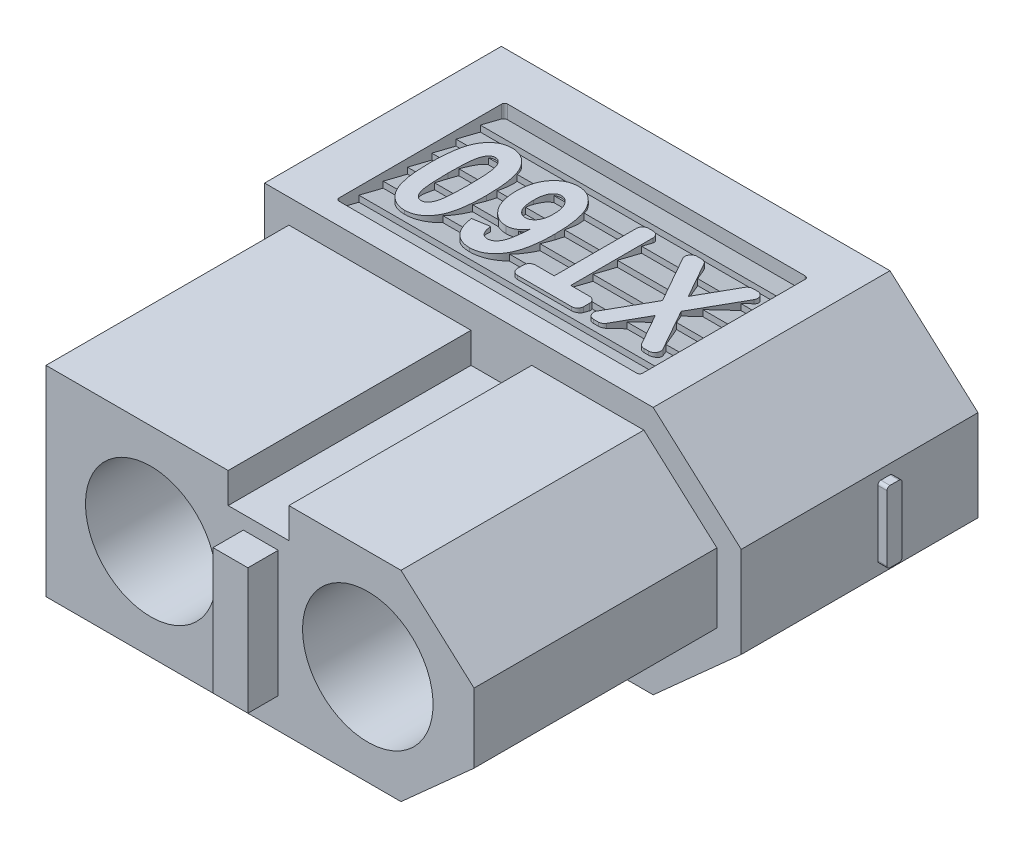
from build123d import *

# Parameters (mm, degrees)
RESSALTO_EXTRUS_O1_DEPTH  = 15.8
CORTE_EXTRUS_O1_DEPTH     = 8
ESBO_O5_R                 = 3
CORTE_EXTRUS_O3_DEPTH     = 2
ESBO_O6_R                 = 2.15
CORTE_EXTRUS_O4_DEPTH     = 23.453730202
RESSALTO_EXTRUS_O3_DEPTH  = 0.3
RESSALTO_EXTRUS_O4_DEPTH  = 0.3
CORTE_EXTRUS_O5_DEPTH     = 0.75
RESSALTO_EXTRUS_O7_REACH  = 24.865
RESSALTO_EXTRUS_O8_DEPTH  = 0.3
RESSALTO_EXTRUS_O9_DEPTH  = 0.3
ESBO_O13_W                = 1.15
ESBO_O13_H                = 4.15
RESSALTO_EXTRUS_O10_DEPTH = 1


with BuildPart() as part:
    # Esboço1 → Ressalto-extrusão1 (new body)
    with BuildSketch(Plane.XY):
        Polygon((0, 0), (12.8, 0), (15.7, 2.6), (15.7, 5.6), (12.8, 8.2), (0, 8.2), align=None)
    extrude(amount=RESSALTO_EXTRUS_O1_DEPTH)

    # Esboço2 → Corte-extrusão1 (cut)
    with BuildSketch(Plane.XY.offset(15.8)):
        Polygon((0, 8.2), (0, 0), (12.8, 0), (15.7, 2.6), (15.7, 5.6), (12.8, 8.2), align=None)
        Polygon((0.8, 7.4), (0.8, 0.8), (12.49388664, 0.8), (14.9, 2.957205081), (14.9, 5.242794919), (12.49388664, 7.4), (8.8, 7.4), (8.8, 6.4), (6.8, 6.4), (6.8, 7.4), align=None, mode=Mode.SUBTRACT)
    extrude(amount=-CORTE_EXTRUS_O1_DEPTH, mode=Mode.SUBTRACT)

    # Esboço5 → Corte-extrusão3 (cut)
    with BuildSketch(Plane(origin=(0, 0, 0), x_dir=(-1, 0, 0), z_dir=(0, 0, -1))):
        with Locations((-11.4, 4.1)):
            Circle(ESBO_O5_R)
        with Locations((-4.25, 4.1)):
            Circle(ESBO_O5_R)
    extrude(amount=-CORTE_EXTRUS_O3_DEPTH, mode=Mode.SUBTRACT)

    # Esboço6 → Corte-extrusão4 (cut, through all)
    with BuildSketch(Plane(origin=(0, 0, 2), x_dir=(-1, 0, 0), z_dir=(0, 0, -1))):
        with Locations((-11.4, 4.1)):
            Circle(ESBO_O6_R)
        with Locations((-4.25, 4.1)):
            Circle(ESBO_O6_R)
    extrude(amount=-CORTE_EXTRUS_O4_DEPTH, mode=Mode.SUBTRACT)

    # Esboço7 → Ressalto-extrusão3 (add)
    with BuildSketch(Plane.ZY):
        with BuildLine():
            Line((2.8, 4.35), (2.05, 4.35))
            ThreePointArc((2.05, 4.35), (1.979289322, 4.320710678), (1.95, 4.25))
            Line((1.95, 4.25), (1.95, 3.95))
            ThreePointArc((1.95, 3.95), (1.979289322, 3.879289322), (2.05, 3.85))
            Line((2.05, 3.85), (2.8, 3.85))
            ThreePointArc((2.8, 3.85), (2.870710678, 3.820710678), (2.9, 3.75))
            Line((2.9, 3.75), (2.9, 3))
            ThreePointArc((2.9, 3), (2.929289322, 2.929289322), (3, 2.9))
            Line((3, 2.9), (3.3, 2.9))
            ThreePointArc((3.3, 2.9), (3.370710678, 2.929289322), (3.4, 3))
            Line((3.4, 3), (3.4, 3.75))
            ThreePointArc((3.4, 3.75), (3.429289322, 3.820710678), (3.5, 3.85))
            Line((3.5, 3.85), (4.25, 3.85))
            ThreePointArc((4.25, 3.85), (4.320710678, 3.879289322), (4.35, 3.95))
            Line((4.35, 3.95), (4.35, 4.25))
            ThreePointArc((4.35, 4.25), (4.320710678, 4.320710678), (4.25, 4.35))
            Line((4.25, 4.35), (3.5, 4.35))
            ThreePointArc((3.5, 4.35), (3.429289322, 4.379289322), (3.4, 4.45))
            Line((3.4, 4.45), (3.4, 5.2))
            ThreePointArc((3.4, 5.2), (3.370710678, 5.270710678), (3.3, 5.3))
            Line((3.3, 5.3), (3, 5.3))
            ThreePointArc((3, 5.3), (2.929289322, 5.270710678), (2.9, 5.2))
            Line((2.9, 5.2), (2.9, 4.45))
            ThreePointArc((2.9, 4.45), (2.870710678, 4.379289322), (2.8, 4.35))
        make_face()
    extrude(amount=RESSALTO_EXTRUS_O3_DEPTH)

    # Esboço8 → Ressalto-extrusão4 (add)
    with BuildSketch(Plane(origin=(15.7, 0, 0), x_dir=(0, 0, -1), z_dir=(1, 0, 0))):
        with BuildLine():
            Line((-3.2, 2.925), (-2.9, 2.925))
            ThreePointArc((-2.9, 2.925), (-2.829289322, 2.954289322), (-2.8, 3.025))
            Line((-2.8, 3.025), (-2.8, 5.175))
            ThreePointArc((-2.8, 5.175), (-2.829289322, 5.245710678), (-2.9, 5.275))
            Line((-2.9, 5.275), (-3.2, 5.275))
            ThreePointArc((-3.2, 5.275), (-3.270710678, 5.245710678), (-3.3, 5.175))
            Line((-3.3, 5.175), (-3.3, 3.025))
            ThreePointArc((-3.3, 3.025), (-3.270710678, 2.954289322), (-3.2, 2.925))
        make_face()
    extrude(amount=RESSALTO_EXTRUS_O4_DEPTH)

    # Esboço9 → Corte-extrusão5 (cut)
    with BuildSketch(Plane.XZ):
        with BuildLine():
            Line((1.75, 7.093123445), (11.55, 7.093123445))
            ThreePointArc((11.55, 7.093123445), (11.620710678, 7.063834123), (11.65, 6.993123445))
            Line((11.65, 6.993123445), (11.65, 1.643123445))
            ThreePointArc((11.65, 1.643123445), (11.620710678, 1.572412766), (11.55, 1.543123445))
            Line((11.55, 1.543123445), (1.75, 1.543123445))
            ThreePointArc((1.75, 1.543123445), (1.679289322, 1.572412766), (1.65, 1.643123445))
            Line((1.65, 1.643123445), (1.65, 6.993123445))
            ThreePointArc((1.65, 6.993123445), (1.679289322, 7.063834123), (1.75, 7.093123445))
        make_face()
    corte_extrus_o5 = extrude(amount=-CORTE_EXTRUS_O5_DEPTH, mode=Mode.SUBTRACT)

    # Ressalto-extrusão7: up to this face of the body (flat: up to its plane)
    ressalto_extrus_o7_end = Plane(part.part.faces().sort_by_distance((11.65, 0.375, 4.318123445))[0])
    # Esboço10 → Ressalto-extrusão7 (add, up to the picked face)
    with BuildSketch(Plane(origin=(1.65, 0, 0), x_dir=(0, 0, -1), z_dir=(1, 0, 0)), mode=Mode.PRIVATE) as ressalto_extrus_o7_sk1:
        Polygon((-3.143123445, 0.45), (-3.143123445, 0.25), (-2.343123445, 0.45), (-2.343123445, 0.25), (-1.543123445, 0.45), (-1.543123445, 0.75), (-7.143123445, 0.75), (-7.143123445, 0.45), (-7.143123445, 0.25), (-6.343123445, 0.45), (-6.343123445, 0.25), (-5.543123445, 0.45), (-5.543123445, 0.25), (-4.743123445, 0.45), (-4.743123445, 0.25), (-3.943123445, 0.45), (-3.943123445, 0.25), align=None)
    ressalto_extrus_o7_tool1 = split(extrude(ressalto_extrus_o7_sk1.sketch, amount=RESSALTO_EXTRUS_O7_REACH, mode=Mode.PRIVATE), bisect_by=ressalto_extrus_o7_end, keep=Keep.BOTH, mode=Mode.PRIVATE)
    ressalto_extrus_o7 = ressalto_extrus_o7_tool1.solids().sort_by(Axis((1.65, 0.545833, 4.376457), (1, 0, 0)))[0]
    add(ressalto_extrus_o7)

    # Espelhar1: Corte-extrusão5, Ressalto-extrusão7 across plane
    add(corte_extrus_o5.mirror(Plane.ZX.offset(4.1)), mode=Mode.SUBTRACT)
    add(ressalto_extrus_o7.mirror(Plane.ZX.offset(4.1)))

    # Esboço11 → Ressalto-extrusão8 (add)
    with BuildSketch(Plane(origin=(0, 0.5, 0), x_dir=(-1, 0, 0), z_dir=(0, -1, 0))):
        with BuildLine():
            Line((-2.594171468, -5.543123445), (-2.816677367, -5.543123445))
            ThreePointArc((-2.816677367, -5.543123445), (-2.931584034, -5.489541586), (-2.96439853, -5.367076218))
            Line((-2.96439853, -5.367076218), (-2.475213344, -2.592769164))
            ThreePointArc((-2.475213344, -2.592769164), (-2.50802784, -2.470303795), (-2.622934507, -2.416721937))
            Line((-2.622934507, -2.416721937), (-2.922945856, -2.416721937))
            ThreePointArc((-2.922945856, -2.416721937), (-3.019363998, -2.45181527), (-3.070667019, -2.54067471))
            Line((-3.070667019, -2.54067471), (-3.578223521, -5.419170671))
            ThreePointArc((-3.578223521, -5.419170671), (-3.629526543, -5.508030111), (-3.725944684, -5.543123445))
            Line((-3.725944684, -5.543123445), (-4.285644183, -5.543123445))
            ThreePointArc((-4.285644183, -5.543123445), (-4.3917102, -5.587057427), (-4.435644183, -5.693123445))
            Line((-4.435644183, -5.693123445), (-4.435644183, -5.993134794))
            ThreePointArc((-4.435644183, -5.993134794), (-4.3917102, -6.099200812), (-4.285644183, -6.143134794))
            Line((-4.285644183, -6.143134794), (-2.594171468, -6.143134794))
            ThreePointArc((-2.594171468, -6.143134794), (-2.48810545, -6.099200812), (-2.444171468, -5.993134794))
            Line((-2.444171468, -5.993134794), (-2.444171468, -5.693123445))
            ThreePointArc((-2.444171468, -5.693123445), (-2.48810545, -5.587057427), (-2.594171468, -5.543123445))
        make_face()
        with BuildLine():
            Line((-7.312799939, -6.143134794), (-5.987200061, -6.143134794))
            ThreePointArc((-5.987200061, -6.143134794), (-5.912200061, -6.123038605), (-5.85729625, -6.068134794))
            Line((-5.85729625, -6.068134794), (-5.828687438, -6.018582878))
            ThreePointArc((-5.828687438, -6.018582878), (-5.681353004, -5.702623165), (-5.591122739, -5.365879233))
            Line((-5.591122739, -5.365879233), (-5.150689111, -2.868056003))
            ThreePointArc((-5.150689111, -2.868056003), (-5.158867923, -2.786982124), (-5.208226408, -2.722146896))
            Line((-5.208226408, -2.722146896), (-5.574105578, -2.446860057))
            ThreePointArc((-5.574105578, -2.446860057), (-5.616746211, -2.424455845), (-5.664289444, -2.416721937))
            Line((-5.664289444, -2.416721937), (-6.747162349, -2.416721937))
            ThreePointArc((-6.747162349, -2.416721937), (-6.822162349, -2.436818126), (-6.877066159, -2.491721937))
            Line((-6.877066159, -2.491721937), (-7.246378339, -3.131389396))
            ThreePointArc((-7.246378339, -3.131389396), (-7.254434815, -3.146865743), (-7.261111782, -3.162985367))
            Line((-7.261111782, -3.162985367), (-7.486707327, -3.782804031))
            ThreePointArc((-7.486707327, -3.782804031), (-7.491953968, -3.799444251), (-7.495730353, -3.816478424))
            Line((-7.495730353, -3.816478424), (-7.600238849, -4.409175555))
            ThreePointArc((-7.600238849, -4.409175555), (-7.567424352, -4.531640924), (-7.452517686, -4.585222782))
            Line((-7.452517686, -4.585222782), (-6.814596908, -4.585222782))
            ThreePointArc((-6.814596908, -4.585222782), (-6.708530891, -4.541288799), (-6.664596908, -4.435222782))
            Line((-6.664596908, -4.435222782), (-6.664596908, -4.135222782))
            ThreePointArc((-6.664596908, -4.135222782), (-6.688852376, -4.053440677), (-6.75377441, -3.998107415))
            ThreePointArc((-6.75377441, -3.998107415), (-6.813094, -3.957706293), (-6.85433126, -3.898964887))
            Line((-6.85433126, -3.898964887), (-6.980409874, -3.625265301))
            ThreePointArc((-6.980409874, -3.625265301), (-6.998662224, -3.535451732), (-6.974936214, -3.446926583))
            Line((-6.974936214, -3.446926583), (-6.800387282, -3.122061179))
            ThreePointArc((-6.800387282, -3.122061179), (-6.726842336, -3.045065082), (-6.624207428, -3.016721937))
            Line((-6.624207428, -3.016721937), (-5.905334252, -3.016721937))
            ThreePointArc((-5.905334252, -3.016721937), (-5.828729808, -3.052443176), (-5.806853477, -3.134086755))
            Line((-5.806853477, -3.134086755), (-6.209775425, -5.419170671))
            ThreePointArc((-6.209775425, -5.419170671), (-6.261078446, -5.508030111), (-6.357496588, -5.543123445))
            Line((-6.357496588, -5.543123445), (-7.076369764, -5.543123445))
            ThreePointArc((-7.076369764, -5.543123445), (-7.152974208, -5.507402206), (-7.174850539, -5.425758627))
            Line((-7.174850539, -5.425758627), (-7.151219061, -5.291737858))
            ThreePointArc((-7.151219061, -5.291737858), (-7.184033558, -5.16927249), (-7.298940224, -5.115690631))
            Line((-7.298940224, -5.115690631), (-7.598951574, -5.115690631))
            ThreePointArc((-7.598951574, -5.115690631), (-7.695369716, -5.150783965), (-7.746672737, -5.239643405))
            Line((-7.746672737, -5.239643405), (-7.826400273, -5.691800728))
            ThreePointArc((-7.826400273, -5.691800728), (-7.81822146, -5.772874607), (-7.768862976, -5.837709835))
            Line((-7.768862976, -5.837709835), (-7.402983805, -6.112996674))
            ThreePointArc((-7.402983805, -6.112996674), (-7.360343172, -6.135400887), (-7.312799939, -6.143134794))
        make_face()
        with BuildLine():
            Line((-8.976581944, -6.143134794), (-9.276593294, -6.143134794))
            ThreePointArc((-9.276593294, -6.143134794), (-9.383119611, -6.098738505), (-9.426587619, -5.991830045))
            Line((-9.426587619, -5.991830045), (-9.419815007, -5.213249059))
            ThreePointArc((-9.419815007, -5.213249059), (-9.453507368, -5.165547636), (-9.509444688, -5.182329089))
            Line((-9.509444688, -5.182329089), (-10.203473932, -6.084589954))
            ThreePointArc((-10.203473932, -6.084589954), (-10.256105062, -6.127704988), (-10.32236865, -6.143134794))
            Line((-10.32236865, -6.143134794), (-10.62238, -6.143134794))
            ThreePointArc((-10.62238, -6.143134794), (-10.756950193, -6.059398382), (-10.741274717, -5.901679635))
            Line((-10.741274717, -5.901679635), (-9.415426652, -4.178033505))
            Line((-9.415426652, -4.178033505), (-9.12671612, -2.54067471))
            ThreePointArc((-9.12671612, -2.54067471), (-9.075413098, -2.45181527), (-8.978994957, -2.416721937))
            Line((-8.978994957, -2.416721937), (-8.678983607, -2.416721937))
            ThreePointArc((-8.678983607, -2.416721937), (-8.56407694, -2.470303795), (-8.531262444, -2.592769164))
            Line((-8.531262444, -2.592769164), (-8.810787319, -4.178033505))
            Line((-8.810787319, -4.178033505), (-8.826587619, -5.994439544))
            ThreePointArc((-8.826587619, -5.994439544), (-8.870978233, -6.099661111), (-8.976581944, -6.143134794))
        make_face()
    extrude(amount=RESSALTO_EXTRUS_O8_DEPTH)

    # Esboço12 → Ressalto-extrusão9 (add)
    # profile 1 of 4: a face of its own
    with BuildSketch(Plane(origin=(0, 7.7, 0), x_dir=(1, 0, 0), z_dir=(0, 1, 0))):
        with BuildLine():
            Line((11.185044584, -2.866454717), (10.320104725, -4.398379126))
            Line((10.320104725, -4.398379126), (11.094198639, -5.769814539))
            ThreePointArc((11.094198639, -5.769814539), (11.092744365, -5.968965447), (10.920028151, -6.068123445))
            Line((10.920028151, -6.068123445), (10.7649422, -6.068123445))
            ThreePointArc((10.7649422, -6.068123445), (10.664138477, -6.040862003), (10.590815302, -5.966509539))
            Line((10.590815302, -5.966509539), (10.012576316, -4.943123445))
            Line((10.012576316, -4.943123445), (9.435030455, -5.966426179))
            ThreePointArc((9.435030455, -5.966426179), (9.361701545, -6.040837872), (9.260856483, -6.068123445))
            Line((9.260856483, -6.068123445), (9.105124481, -6.068123445))
            ThreePointArc((9.105124481, -6.068123445), (8.932408267, -5.968965447), (8.930953993, -5.769814539))
            Line((8.930953993, -5.769814539), (9.705047907, -4.398379126))
            Line((9.705047907, -4.398379126), (8.840108048, -2.866454717))
            ThreePointArc((8.840108048, -2.866454717), (8.841543221, -2.667292533), (9.01426591, -2.568123445))
            Line((9.01426591, -2.568123445), (9.169940798, -2.568123445))
            ThreePointArc((9.169940798, -2.568123445), (9.270790107, -2.595411497), (9.344119604, -2.669829276))
            Line((9.344119604, -2.669829276), (10.012576316, -3.854345035))
            Line((10.012576316, -3.854345035), (10.681728288, -2.669756355))
            ThreePointArc((10.681728288, -2.669756355), (10.755052773, -2.595390388), (10.855865922, -2.568123445))
            Line((10.855865922, -2.568123445), (11.010886722, -2.568123445))
            ThreePointArc((11.010886722, -2.568123445), (11.183609411, -2.667292533), (11.185044584, -2.866454717))
        make_face()
    # profile 2 of 4: a face of its own
    with BuildSketch(Plane(origin=(0, 7.7, 0), x_dir=(1, 0, 0), z_dir=(0, 1, 0))):
        with BuildLine():
            Line((7.762576316, -2.768123445), (7.762576316, -5.477214354))
            Line((7.762576316, -5.477214354), (8.380758134, -5.477214354))
            ThreePointArc((8.380758134, -5.477214354), (8.522179491, -5.535792997), (8.580758134, -5.677214354))
            Line((8.580758134, -5.677214354), (8.580758134, -5.868123445))
            ThreePointArc((8.580758134, -5.868123445), (8.522179491, -6.009544801), (8.380758134, -6.068123445))
            Line((8.380758134, -6.068123445), (6.598939953, -6.068123445))
            ThreePointArc((6.598939953, -6.068123445), (6.457518596, -6.009544801), (6.398939953, -5.868123445))
            Line((6.398939953, -5.868123445), (6.398939953, -5.677214354))
            ThreePointArc((6.398939953, -5.677214354), (6.457518596, -5.535792997), (6.598939953, -5.477214354))
            Line((6.598939953, -5.477214354), (7.217121771, -5.477214354))
            Line((7.217121771, -5.477214354), (7.217121771, -2.768123445))
            ThreePointArc((7.217121771, -2.768123445), (7.275700414, -2.626702088), (7.417121771, -2.568123445))
            Line((7.417121771, -2.568123445), (7.562576316, -2.568123445))
            ThreePointArc((7.562576316, -2.568123445), (7.703997672, -2.626702088), (7.762576316, -2.768123445))
        make_face()
    # profile 3 of 4: a face of its own
    with BuildSketch(Plane(origin=(0, 7.7, 0), x_dir=(1, 0, 0), z_dir=(0, 1, 0))):
        with BuildLine():
            Line((4.217121771, -5.204487081), (4.762576316, -5.11357799))
            add(Edge.make_bspline(
                [(4.762576316, -5.11357799), (4.76820949, -5.173924633), (4.781337444, -5.259439061), (4.819168165, -5.361191101), (4.853361229, -5.419789109), (4.894424887, -5.466597978), (4.961777465, -5.510957772), (5.022038471, -5.523265851), (5.062292225, -5.522668899)],
                knots=[0, 0, 0, 0, 0.323351038, 0.457031878, 0.575725889, 0.682827962, 0.785621923, 1, 1, 1, 1], degree=3))
            add(Edge.make_bspline(
                [(5.062292225, -5.522668899), (5.090005536, -5.523271256), (5.131240753, -5.516505903), (5.183240033, -5.496464747), (5.220091612, -5.475090137), (5.254809063, -5.44738128), (5.287295538, -5.413652015), (5.318784831, -5.374418203), (5.348496948, -5.327992624), (5.375862324, -5.27190132), (5.400526587, -5.204375405), (5.42080653, -5.124170881), (5.441377932, -5.032489264), (5.456741962, -4.927718403), (5.47688134, -4.763925871), (5.485298827, -4.634283794), (5.489849043, -4.543975717)],
                knots=[0, 0, 0, 0, 0.07110629, 0.106432223, 0.14303469, 0.180361233, 0.220458154, 0.263402163, 0.309743564, 0.362096385, 0.423824058, 0.494518004, 0.575001043, 0.665717727, 0.767054977, 1, 1, 1, 1], degree=3))
            add(Edge.make_bspline(
                [(5.489849043, -4.543975717), (5.458325439, -4.59029492), (5.407025482, -4.654615722), (5.327609617, -4.725483765), (5.267100836, -4.768088661), (5.202789438, -4.800226136), (5.112590312, -4.832606749), (5.040111771, -4.83988466), (4.991979725, -4.840850717)],
                knots=[0, 0, 0, 0, 0.277998008, 0.405177954, 0.526602292, 0.643637452, 0.760548992, 1, 1, 1, 1], degree=3))
            add(Edge.make_bspline(
                [(4.991979725, -4.840850717), (4.938397795, -4.840049228), (4.857644594, -4.832427325), (4.755876709, -4.798007625), (4.682335645, -4.763632003), (4.610596897, -4.720231075), (4.542640345, -4.665558625), (4.476889163, -4.601961344), (4.414752476, -4.529006286), (4.357734038, -4.448067208), (4.307371702, -4.360004902), (4.266071161, -4.265189584), (4.230469873, -4.164568314), (4.205010426, -4.057053869), (4.1786726, -3.902079336), (4.170937798, -3.781658743), (4.171667225, -3.69951549)],
                knots=[0, 0, 0, 0, 0.103373273, 0.154207333, 0.205955138, 0.259297376, 0.315055498, 0.373346508, 0.435038939, 0.499094576, 0.56354236, 0.62980043, 0.697776404, 0.768573701, 0.842016383, 1, 1, 1, 1], degree=3))
            add(Edge.make_bspline(
                [(4.171667225, -3.69951549), (4.17185896, -3.612421658), (4.179060828, -3.485146498), (4.205900348, -3.321369203), (4.234396433, -3.20963002), (4.2696034, -3.104366118), (4.314707671, -3.007473367), (4.366288245, -2.916922605), (4.426957594, -2.835664661), (4.492885026, -2.762488286), (4.56321129, -2.698010574), (4.638016826, -2.644053991), (4.716117978, -2.599205297), (4.798442704, -2.564863658), (4.914867128, -2.532610579), (5.005897079, -2.522349793), (5.067263816, -2.522668899)],
                knots=[0, 0, 0, 0, 0.157846943, 0.230497149, 0.300424491, 0.366636184, 0.431332033, 0.493808926, 0.555163499, 0.614703094, 0.672106668, 0.727718583, 0.781520235, 0.834985538, 0.88891022, 1, 1, 1, 1], degree=3))
            add(Edge.make_bspline(
                [(5.067263816, -2.522668899), (5.134776318, -2.522388948), (5.235013241, -2.535219464), (5.362092148, -2.577511404), (5.451550186, -2.622540527), (5.536655096, -2.680446511), (5.616741921, -2.751072456), (5.692332527, -2.834441462), (5.763971124, -2.930110778), (5.82918472, -3.04081959), (5.883929661, -3.168816952), (5.931571611, -3.312472802), (5.969029009, -3.473320865), (5.999665981, -3.650168244), (6.028262771, -3.919162037), (6.035311504, -4.129776969), (6.035303589, -4.275509808)],
                knots=[0, 0, 0, 0, 0.090693495, 0.134685131, 0.179530034, 0.224912922, 0.272737739, 0.322760271, 0.375986421, 0.433203955, 0.495069598, 0.562818628, 0.636478469, 0.716917714, 0.804030531, 1, 1, 1, 1], degree=3))
            add(Edge.make_bspline(
                [(6.035303589, -4.275509808), (6.035321208, -4.423581802), (6.028586042, -4.637939475), (5.997249035, -4.911199563), (5.966641992, -5.091655496), (5.926254815, -5.255456188), (5.877882298, -5.403133674), (5.820063121, -5.534267496), (5.751835344, -5.647887006), (5.677444095, -5.746891367), (5.597624044, -5.832519938), (5.513228762, -5.905957941), (5.422406745, -5.96445997), (5.327623343, -6.011484887), (5.191786058, -6.055622146), (5.084345761, -6.068641489), (5.011866089, -6.068123445)],
                knots=[0, 0, 0, 0, 0.192657569, 0.278521348, 0.357596923, 0.430563241, 0.497752602, 0.559502274, 0.616536619, 0.669746994, 0.720292489, 0.768554988, 0.814846956, 0.860430936, 0.905808517, 1, 1, 1, 1], degree=3))
            add(Edge.make_bspline(
                [(5.011866089, -6.068123445), (4.961903446, -6.06789345), (4.888028114, -6.061626473), (4.793001037, -6.039603881), (4.725795095, -6.016102048), (4.661944049, -5.985106158), (4.600204149, -5.948907027), (4.541772821, -5.905419857), (4.487247773, -5.854566598), (4.43554269, -5.798076733), (4.390262811, -5.733146732), (4.348758109, -5.662053174), (4.313065822, -5.583489418), (4.280538021, -5.498839828), (4.24537643, -5.372392174), (4.226035204, -5.273167916), (4.217121771, -5.204487081)],
                knots=[0, 0, 0, 0, 0.115543302, 0.170649433, 0.225187049, 0.279790566, 0.334525644, 0.390473716, 0.447810616, 0.506730268, 0.567186295, 0.630471054, 0.696846024, 0.766492743, 0.839958973, 1, 1, 1, 1], degree=3))
        make_face()
        with BuildLine():
            add(Edge.make_bspline(
                [(5.444394498, -3.721532535), (5.443413243, -3.671816504), (5.441774499, -3.598919405), (5.428964767, -3.50575196), (5.416513606, -3.442460626), (5.39901126, -3.384318695), (5.379738685, -3.329960639), (5.355461716, -3.280752232), (5.327421984, -3.236743151), (5.298038654, -3.197058094), (5.266817632, -3.162801594), (5.234319039, -3.134257306), (5.201874492, -3.109517602), (5.167408759, -3.090781113), (5.119948206, -3.073930539), (5.082776396, -3.068257967), (5.058030862, -3.068123445)],
                knots=[0, 0, 0, 0, 0.178482482, 0.260708928, 0.336947951, 0.40946762, 0.47821344, 0.543503214, 0.605672981, 0.665087478, 0.720355931, 0.771459165, 0.820010483, 0.866344773, 0.911449985, 1, 1, 1, 1], degree=3))
            add(Edge.make_bspline(
                [(5.058030862, -3.068123445), (5.011333584, -3.067304655), (4.939791649, -3.085797467), (4.86264655, -3.146956505), (4.819952016, -3.197224746), (4.79035383, -3.246363095), (4.770537869, -3.289704134), (4.754443985, -3.338919978), (4.740189246, -3.393143293), (4.729596718, -3.453239822), (4.72052411, -3.544234997), (4.716316659, -3.615360982), (4.717121771, -3.664714354)],
                knots=[0, 0, 0, 0, 0.182717956, 0.277311697, 0.381920987, 0.439334057, 0.501576805, 0.568145713, 0.64192066, 0.721049878, 0.806868135, 1, 1, 1, 1], degree=3))
            add(Edge.make_bspline(
                [(4.717121771, -3.664714354), (4.717023666, -3.715881874), (4.71928254, -3.790108644), (4.731260972, -3.884669406), (4.742289738, -3.947647624), (4.757256441, -4.005038937), (4.774726651, -4.057271853), (4.795918712, -4.103878339), (4.828454634, -4.156184323), (4.87337471, -4.211354153), (4.957448965, -4.275083227), (5.032786713, -4.296660278), (5.082888816, -4.295396172)],
                knots=[0, 0, 0, 0, 0.189207564, 0.273855027, 0.352111634, 0.425324443, 0.49283636, 0.555472207, 0.61399486, 0.72019415, 0.816437051, 1, 1, 1, 1], degree=3))
            add(Edge.make_bspline(
                [(5.082888816, -4.295396172), (5.131526314, -4.295488538), (5.205689597, -4.276323592), (5.287703716, -4.214653218), (5.333020871, -4.162954728), (5.365244164, -4.113471075), (5.386562707, -4.070535517), (5.404216359, -4.023081599), (5.419178051, -3.971365378), (5.430172085, -3.91499019), (5.442161504, -3.831586596), (5.444525217, -3.766315864), (5.444394498, -3.721532535)],
                knots=[0, 0, 0, 0, 0.192976457, 0.293260508, 0.40387877, 0.464412825, 0.527516319, 0.593906739, 0.665362139, 0.741185596, 0.82193725, 1, 1, 1, 1], degree=3))
        make_face(mode=Mode.SUBTRACT)
    # profile 4 of 4: a face of its own
    with BuildSketch(Plane(origin=(0, 7.7, 0), x_dir=(1, 0, 0), z_dir=(0, 1, 0))):
        with BuildLine():
            add(Edge.make_bspline(
                [(2.877633134, -6.068123445), (2.810730433, -6.067849084), (2.711314347, -6.056349671), (2.585994956, -6.0147115), (2.498310016, -5.971140602), (2.415902857, -5.914953241), (2.338568607, -5.846563404), (2.266246061, -5.765980633), (2.198470254, -5.672487326), (2.137564732, -5.563141791), (2.085547014, -5.43597675), (2.041861983, -5.290553015), (2.006259497, -5.126888157), (1.978040904, -4.944750096), (1.951290686, -4.665360773), (1.9446089, -4.446077253), (1.944394498, -4.293975717)],
                knots=[0, 0, 0, 0, 0.089720065, 0.13287086, 0.176439702, 0.220535808, 0.266180481, 0.314487638, 0.365396204, 0.420661105, 0.481833882, 0.5491908, 0.623951051, 0.706174952, 0.796103949, 1, 1, 1, 1], degree=3))
            add(Edge.make_bspline(
                [(1.944394498, -4.293975717), (1.944638719, -4.142353226), (1.951233344, -3.923761612), (1.97812578, -3.645109231), (2.006115325, -3.463394365), (2.042144964, -3.299848), (2.08521413, -3.154455192), (2.137775908, -3.027506965), (2.19840458, -2.918257183), (2.26630614, -2.825073804), (2.337841143, -2.744006751), (2.415214295, -2.675842312), (2.497463758, -2.619864691), (2.584721063, -2.575889294), (2.709503059, -2.534751072), (2.808285478, -2.522615935), (2.874792225, -2.522668899)],
                knots=[0, 0, 0, 0, 0.20374449, 0.293570465, 0.37598958, 0.450616808, 0.518437924, 0.579462338, 0.634858447, 0.685887879, 0.734097166, 0.779850207, 0.824051004, 0.867438546, 0.910691788, 1, 1, 1, 1], degree=3))
            add(Edge.make_bspline(
                [(2.874792225, -2.522668899), (2.941484266, -2.523710824), (3.041281588, -2.533299712), (3.166214895, -2.575602655), (3.254335121, -2.618030045), (3.336271187, -2.674506287), (3.413868558, -2.742018188), (3.486229751, -2.821916845), (3.541301575, -2.897840806), (3.58269805, -2.96498955), (3.611578144, -3.021150661), (3.638494695, -3.081976307), (3.664404568, -3.147121215), (3.686601305, -3.217861571), (3.708035904, -3.292850452), (3.727138607, -3.372484959), (3.744019269, -3.456881892), (3.759963805, -3.545815866), (3.772136852, -3.639993555), (3.784042777, -3.73839755), (3.79197113, -3.841982247), (3.799364724, -3.949918137), (3.805668325, -4.103578693), (3.808979936, -4.221020489), (3.808030862, -4.30107799)],
                knots=[0, 0, 0, 0, 0.089417833, 0.132451122, 0.17576164, 0.219737665, 0.265049642, 0.312990798, 0.36350462, 0.390208605, 0.418376443, 0.447842402, 0.479107586, 0.512034425, 0.546898156, 0.583358489, 0.621466834, 0.661945644, 0.704106633, 0.74838679, 0.794432191, 0.842955807, 0.893007524, 1, 1, 1, 1], degree=3))
            add(Edge.make_bspline(
                [(3.808030862, -4.30107799), (3.807817856, -4.452232991), (3.801141288, -4.670100701), (3.77439671, -4.947596735), (3.746123955, -5.128547937), (3.710429855, -5.2914618), (3.667063402, -5.436528845), (3.614663538, -5.563289526), (3.554017471, -5.672534186), (3.486120024, -5.765718776), (3.414584018, -5.846785534), (3.337211115, -5.914950047), (3.254961588, -5.970927649), (3.1677043, -6.014903051), (3.042922298, -6.056041271), (2.944139883, -6.068176409), (2.877633134, -6.068123445)],
                knots=[0, 0, 0, 0, 0.203492419, 0.293170916, 0.375115996, 0.449884158, 0.517528497, 0.578668156, 0.63416888, 0.68529468, 0.73359501, 0.779434455, 0.823718726, 0.867188205, 0.91052313, 1, 1, 1, 1], degree=3))
        make_face()
        with BuildLine():
            add(Edge.make_bspline(
                [(2.87621268, -5.522668899), (2.901364042, -5.522485609), (2.939097549, -5.515660071), (2.985335807, -5.493598364), (3.017683977, -5.469594025), (3.047216064, -5.438647253), (3.075339951, -5.401740483), (3.101506106, -5.358172557), (3.12641129, -5.306134624), (3.149342747, -5.241231001), (3.166151656, -5.159207953), (3.182876915, -5.059800058), (3.194653181, -4.94184505), (3.205633471, -4.805970595), (3.214801743, -4.587864315), (3.217213683, -4.415214807), (3.217121771, -4.293975717)],
                knots=[0, 0, 0, 0, 0.054971734, 0.082543038, 0.111449392, 0.142585763, 0.175843141, 0.212799818, 0.253577709, 0.301907888, 0.362981983, 0.436474838, 0.522452758, 0.62221279, 0.734739184, 1, 1, 1, 1], degree=3))
            add(Edge.make_bspline(
                [(3.217121771, -4.293975717), (3.21723583, -4.172972758), (3.214784306, -4.000561073), (3.205636937, -3.782690927), (3.1946447, -3.646816985), (3.182924905, -3.529093066), (3.166201502, -3.430144515), (3.149194996, -3.348656915), (3.126599369, -3.284100945), (3.10136876, -3.232430205), (3.075070877, -3.189035557), (3.047700598, -3.151480559), (3.017409268, -3.12122859), (2.985369959, -3.097161665), (2.939075289, -3.075153336), (2.90137521, -3.068296168), (2.87621268, -3.068123445)],
                knots=[0, 0, 0, 0, 0.265261864, 0.37800881, 0.477964371, 0.564110808, 0.637235602, 0.697923266, 0.746348172, 0.786738496, 0.823767607, 0.857503931, 0.888332168, 0.917295178, 0.944920522, 1, 1, 1, 1], degree=3))
            add(Edge.make_bspline(
                [(2.87621268, -3.068123445), (2.850853743, -3.06826339), (2.812769868, -3.074946916), (2.766299747, -3.09740445), (2.733342983, -3.120920239), (2.703673517, -3.152483033), (2.674972494, -3.18923417), (2.649713603, -3.233592599), (2.624355717, -3.285184399), (2.602790537, -3.350256609), (2.58540287, -3.431527346), (2.568868237, -3.530529492), (2.556880667, -3.647964997), (2.547054602, -3.783677003), (2.537421398, -4.001016412), (2.53533009, -4.17322022), (2.535303589, -4.293975717)],
                knots=[0, 0, 0, 0, 0.055564279, 0.083173738, 0.112539997, 0.143719458, 0.177750147, 0.214491628, 0.255325951, 0.303553145, 0.364205914, 0.437288662, 0.523385566, 0.622727249, 0.735409366, 1, 1, 1, 1], degree=3))
            add(Edge.make_bspline(
                [(2.535303589, -4.293975717), (2.535358365, -4.415203081), (2.537372615, -4.587884379), (2.547093196, -4.805928634), (2.55683239, -4.941884397), (2.568925317, -5.059781156), (2.58543415, -5.159253805), (2.602692398, -5.241029088), (2.624346813, -5.306328369), (2.64975742, -5.357875374), (2.674734641, -5.402217911), (2.703911573, -5.438360922), (2.733316363, -5.469892787), (2.766306204, -5.493382877), (2.812765639, -5.515848713), (2.850855904, -5.522527274), (2.87621268, -5.522668899)],
                knots=[0, 0, 0, 0, 0.265054696, 0.377493652, 0.477137187, 0.563048299, 0.636484046, 0.697510684, 0.745633806, 0.786380011, 0.823042207, 0.85659068, 0.887702857, 0.917005746, 0.944555625, 1, 1, 1, 1], degree=3))
        make_face(mode=Mode.SUBTRACT)
    extrude(amount=RESSALTO_EXTRUS_O9_DEPTH)

    # Esboço13 → Ressalto-extrusão10 (add)
    with BuildSketch(Plane.XY.offset(15.8)):
        with Locations((7.875, 3.875)):
            Rectangle(ESBO_O13_W, ESBO_O13_H)
    extrude(amount=RESSALTO_EXTRUS_O10_DEPTH)


solid = part.part
